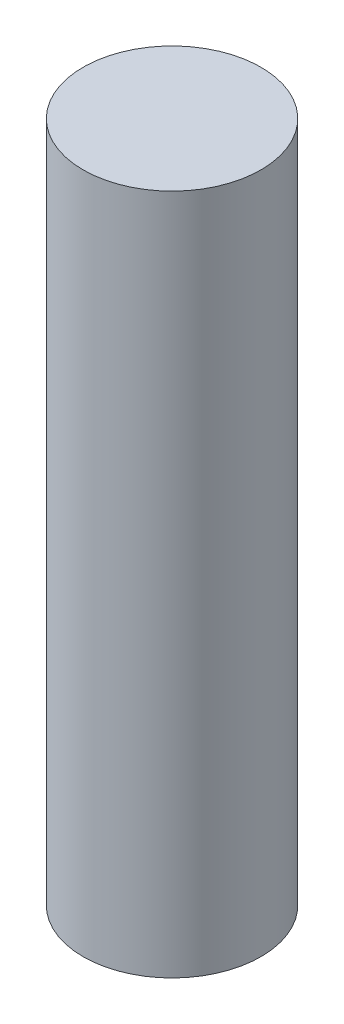
from build123d import *

# Parameters (mm, degrees)
SKETCH1_R           = 1.925
BOSS_EXTRUDE1_DEPTH = 14.75


with BuildPart() as part:
    # Sketch1 → Boss-Extrude1 (new body)
    with BuildSketch(Plane(origin=(0, 0, 0), x_dir=(1, 0, 0), z_dir=(0, 1, 0))):
        with Locations(Location((0, 45.445, 0), (0, 0, 270))):
            Circle(SKETCH1_R)
    extrude(amount=BOSS_EXTRUDE1_DEPTH)


solid = part.part
